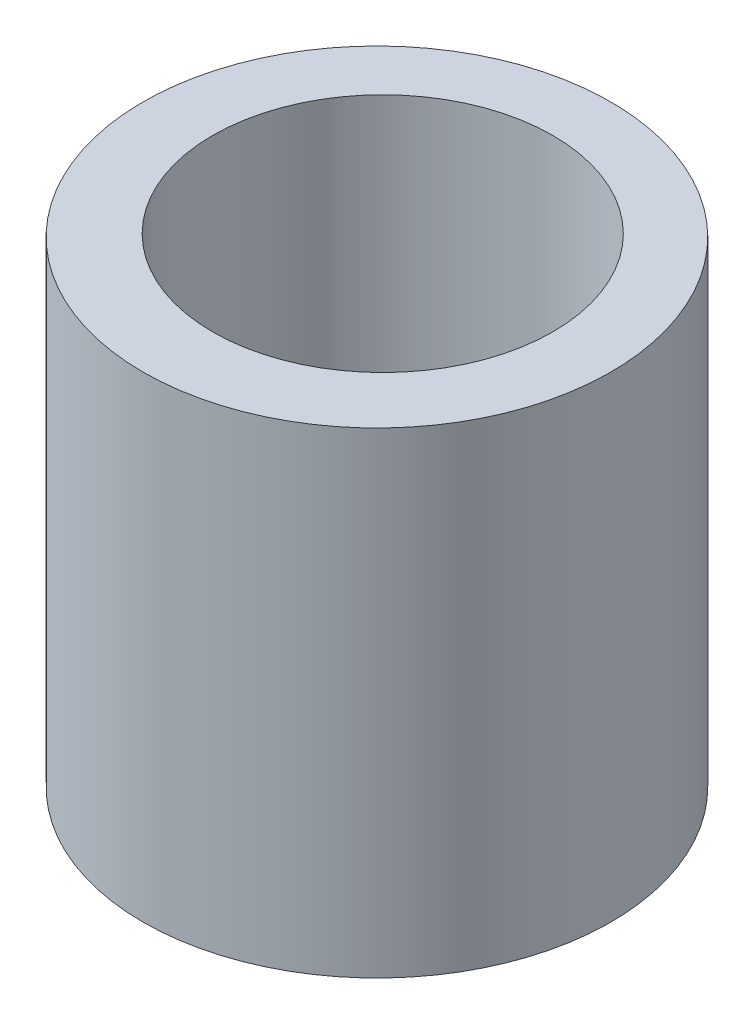
from build123d import *

# Parameters (mm, degrees)
SKETCH1_R           = 6.985
SKETCH1_R_2         = 5.08
BOSS_EXTRUDE1_DEPTH = 14.224


with BuildPart() as part:
    # Sketch1 → Boss-Extrude1 (new body)
    with BuildSketch(Plane(origin=(0, 0, 0), x_dir=(1, 0, 0), z_dir=(0, 1, 0))):
        with Locations(Location((0, -0.172602909, 0), (0, 0, 270))):
            Circle(SKETCH1_R)
        with Locations(Location((0, 0, 0), (0, 0, 270))):
            Circle(SKETCH1_R_2, mode=Mode.SUBTRACT)
    extrude(amount=BOSS_EXTRUDE1_DEPTH)


solid = part.part
